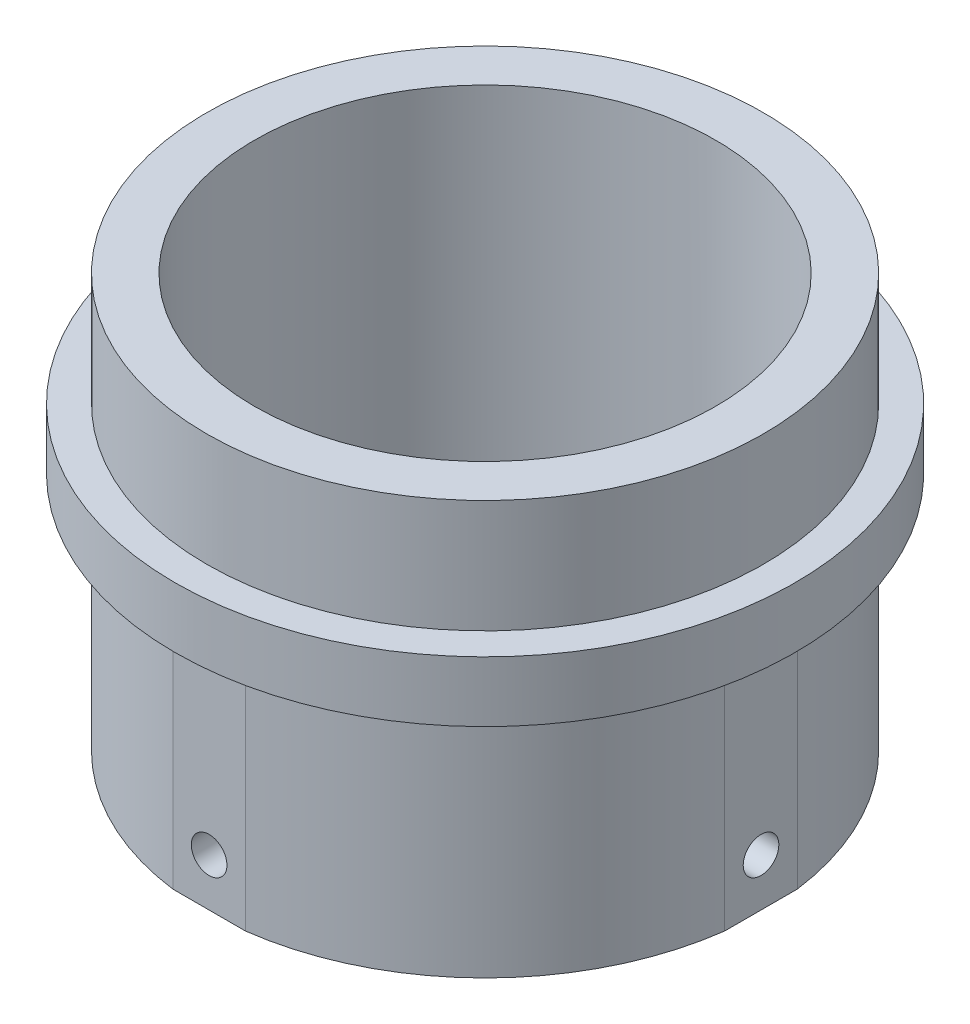
from build123d import *

# Parameters (mm, degrees)
SKETCH1_R               = 22.225
SKETCH1_R_2             = 18.415
BOSS_EXTRUDE1_DEPTH     = 33.02
CUT_EXTRUDE1_DEPTH      = 43.18
CUT_EXTRUDE1_DEPTH_BACK = 43.18
SKETCH2_R               = 1.4224
CUT_EXTRUDE2_DEPTH      = 43.18
CUT_EXTRUDE2_DEPTH_BACK = 43.18
SKETCH3_R               = 1.4224
SKETCH4_W               = 49.025527768
SKETCH4_H               = 48.000320082
SKETCH4_W_2             = 44.069
SKETCH4_H_2             = 44.069
CUT_EXTRUDE3_DEPTH      = 19.177
BOSS_EXTRUDE2_START     = -4.826
SKETCH5_R               = 24.765
SKETCH5_R_2             = 18.415
BOSS_EXTRUDE2_DEPTH     = 4.826


with BuildPart() as part:
    # Sketch1 → Boss-Extrude1 (new body)
    with BuildSketch(Plane(origin=(0, 0, 0), x_dir=(1, 0, 0), z_dir=(0, 1, 0))):
        Circle(SKETCH1_R)
        Circle(SKETCH1_R_2, mode=Mode.SUBTRACT)
    extrude(amount=BOSS_EXTRUDE1_DEPTH)

    # Sketch2 → Cut-Extrude1 (cut, two sides: drawn at the far end of the back side and taken through both)
    with BuildSketch(Plane.XY.offset(-CUT_EXTRUDE1_DEPTH_BACK)):
        with Locations((0, 3.81)):
            Circle(SKETCH2_R)
    extrude(amount=CUT_EXTRUDE1_DEPTH + CUT_EXTRUDE1_DEPTH_BACK, mode=Mode.SUBTRACT)

    # Sketch3 → Cut-Extrude2 (cut, two sides: drawn at the far end of the back side and taken through both)
    with BuildSketch(Plane(origin=(0, 0, 0), x_dir=(0, 0, -1), z_dir=(1, 0, 0)).offset(-CUT_EXTRUDE2_DEPTH_BACK)):
        with Locations((0, 3.81)):
            Circle(SKETCH3_R)
    extrude(amount=CUT_EXTRUDE2_DEPTH + CUT_EXTRUDE2_DEPTH_BACK, mode=Mode.SUBTRACT)

    # Sketch4 → Cut-Extrude3 (cut)
    with BuildSketch(Plane.XZ):
        Rectangle(SKETCH4_W, SKETCH4_H)
        Rectangle(SKETCH4_W_2, SKETCH4_H_2, mode=Mode.SUBTRACT)
    extrude(amount=-CUT_EXTRUDE3_DEPTH, mode=Mode.SUBTRACT)

    # Sketch5 → Boss-Extrude2 (add)
    with BuildSketch(Plane(origin=(0, 24.003, 0), x_dir=(1, 0, 0), z_dir=(0, 1, 0)).offset(BOSS_EXTRUDE2_START)):
        Circle(SKETCH5_R)
        Circle(SKETCH5_R_2, mode=Mode.SUBTRACT)
    extrude(amount=BOSS_EXTRUDE2_DEPTH)


solid = part.part
